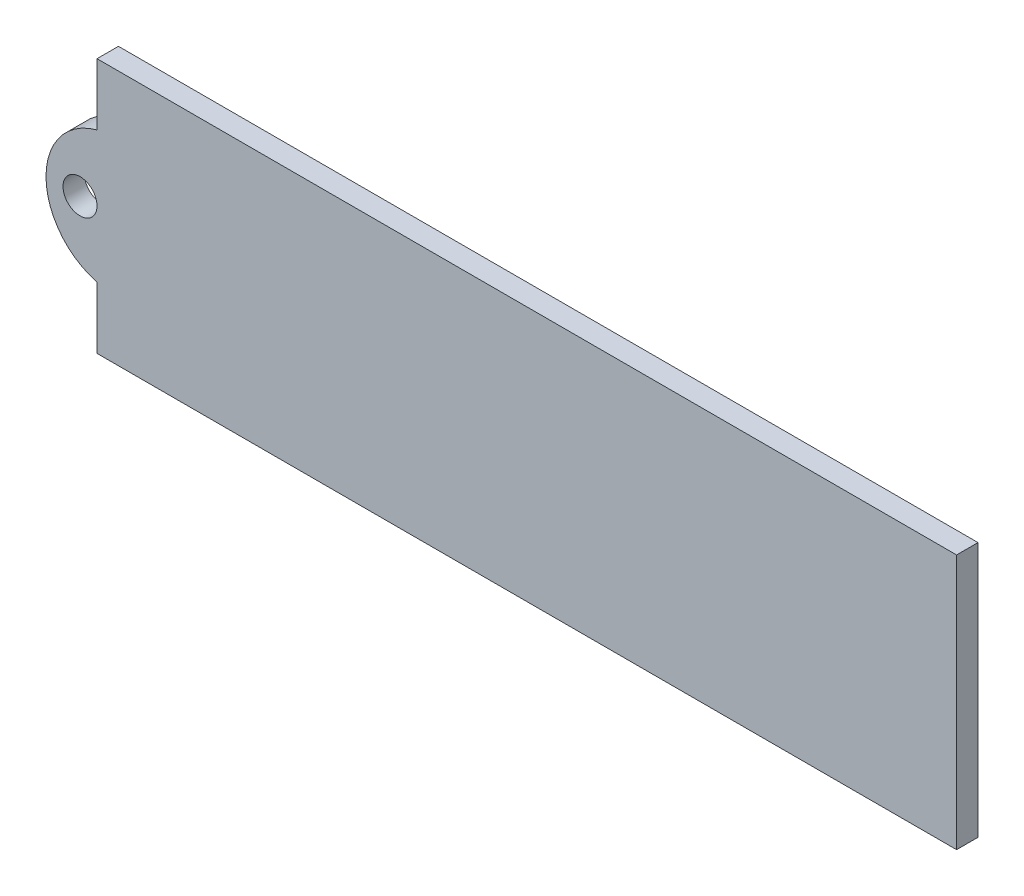
from build123d import *

# Parameters (mm, degrees)
SKETCH2_R           = 6.35
SKETCH2_W           = 80.2259
SKETCH2_H           = 23.8252
SKETCH2_W_2         = 77.0509
SKETCH2_H_2         = 20.6502
BOSS_EXTRUDE1_DEPTH = 2
SKETCH5_R           = 1.5875
CUT_EXTRUDE1_DEPTH  = 2.54


with BuildPart() as part:
    # Sketch2 → Boss-Extrude1 (new body)
    # profile 1 of 7: a face of its own
    with BuildSketch(Plane.XY):
        with BuildLine():
            Line((-40.11295, -6.148361062), (-40.11295, 6.148361062))
            ThreePointArc((-40.11295, 6.148361062), (-44.87545, 0), (-40.11295, -6.148361062))
        make_face()
    # profile 2 of 7: a face of its own
    with BuildSketch(Plane.XY):
        with BuildLine():
            Line((-38.52545, -6.35), (-38.52545, 6.35))
            ThreePointArc((-38.52545, 6.35), (-39.325577257, 6.299388571), (-40.11295, 6.148361062))
            Line((-40.11295, 6.148361062), (-40.11295, -6.148361062))
            ThreePointArc((-40.11295, -6.148361062), (-39.325577257, -6.299388571), (-38.52545, -6.35))
        make_face()
    # profile 3 of 7: a face of its own
    with BuildSketch(Plane.XY):
        with Locations((-38.52545, 0)):
            Circle(SKETCH2_R)
    # profile 4 of 7: a face of its own
    with BuildSketch(Plane.XY):
        with Locations((-38.52545, 0)):
            Circle(SKETCH2_R)
    # profile 5 of 7: a face of its own
    with BuildSketch(Plane.XY):
        Rectangle(SKETCH2_W, SKETCH2_H)
        Rectangle(SKETCH2_W_2, SKETCH2_H_2, mode=Mode.SUBTRACT)
    # profile 6 of 7: a face of its own
    with BuildSketch(Plane.XY):
        Rectangle(SKETCH2_W_2, SKETCH2_H_2)
    # profile 7 of 7: a face of its own
    with BuildSketch(Plane.XY):
        with BuildLine():
            ThreePointArc((-32.17545, 0), (-34.035321939, 4.490128061), (-38.52545, 6.35))
            Line((-38.52545, 6.35), (-38.52545, -6.35))
            ThreePointArc((-38.52545, -6.35), (-34.035321939, -4.490128061), (-32.17545, 0))
        make_face()
    extrude(amount=BOSS_EXTRUDE1_DEPTH)

    # Sketch5 → Cut-Extrude1 (cut)
    with BuildSketch(Plane(origin=(0, 0, 0), x_dir=(-1, 0, 0), z_dir=(0, 0, -1))):
        with Locations((41.70045, 0)):
            Circle(SKETCH5_R)
    extrude(amount=-CUT_EXTRUDE1_DEPTH, mode=Mode.SUBTRACT)


solid = part.part
